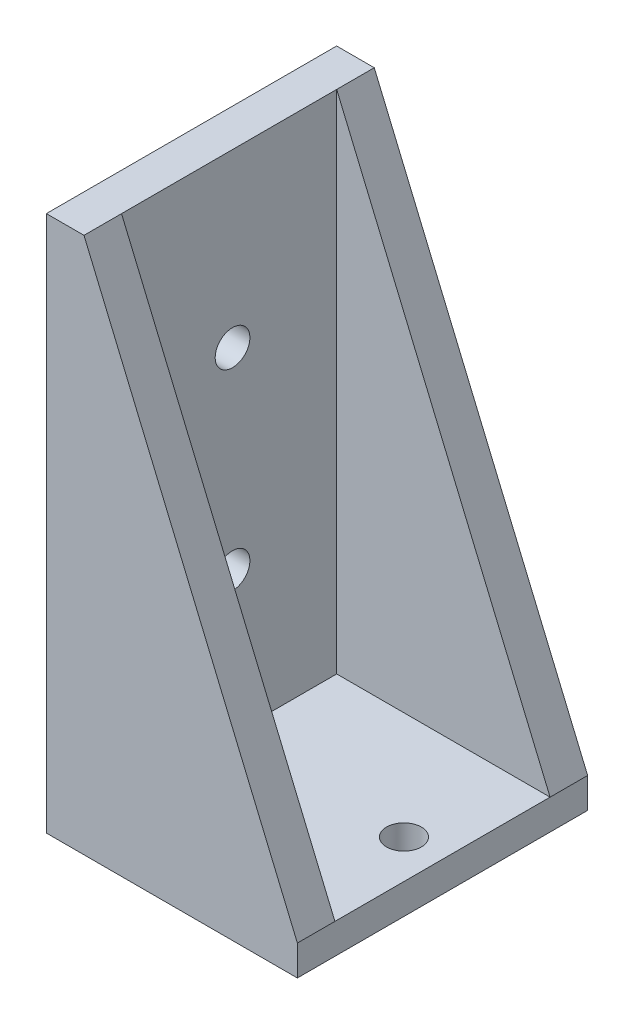
from build123d import *

# Parameters (mm, degrees)
BOSS_EXTRUDE1_DEPTH = 14.224
SKETCH2_W           = 10.456669683
SKETCH2_H           = 10.544
CUT_EXTRUDE1_DEPTH  = 24.807321
SKETCH3_R           = 0.8509
CUT_EXTRUDE2_DEPTH  = 10
SKETCH4_R           = 0.8509
CUT_EXTRUDE3_DEPTH  = 1.482678733


with BuildPart() as part:
    # Sketch1 → Boss-Extrude1 (new body)
    with BuildSketch(Plane.XY):
        Polygon((1.843330317, 26.29), (12.3, 1.482678733), (12.3, 0), (0, 0), (0, 26.29), align=None)
    extrude(amount=BOSS_EXTRUDE1_DEPTH)

    # Sketch2 → Cut-Extrude1 (cut)
    with BuildSketch(Plane(origin=(0, 26.29, 0), x_dir=(1, 0, 0), z_dir=(0, 1, 0))):
        with Locations((7.071665159, -7.112)):
            Rectangle(SKETCH2_W, SKETCH2_H)
    extrude(amount=-CUT_EXTRUDE1_DEPTH, mode=Mode.SUBTRACT)

    # Sketch3 → Cut-Extrude2 (cut)
    with BuildSketch(Plane.ZY):
        with Locations((6.943990858, 17.883471262)):
            Circle(SKETCH3_R)
        with Locations((6.943990858, 8.417089843)):
            Circle(SKETCH3_R)
    extrude(amount=-CUT_EXTRUDE2_DEPTH, mode=Mode.SUBTRACT)

    # Sketch4 → Cut-Extrude3 (cut)
    with BuildSketch(Plane.XZ):
        with Locations(Location((10.409934908, 7.112, 0), (0, 0, 270))):
            Circle(SKETCH4_R)
        with Locations(Location((0.943553489, 7.112, 0), (0, 0, 270))):
            Circle(SKETCH4_R)
    extrude(amount=-CUT_EXTRUDE3_DEPTH, mode=Mode.SUBTRACT)


solid = part.part
